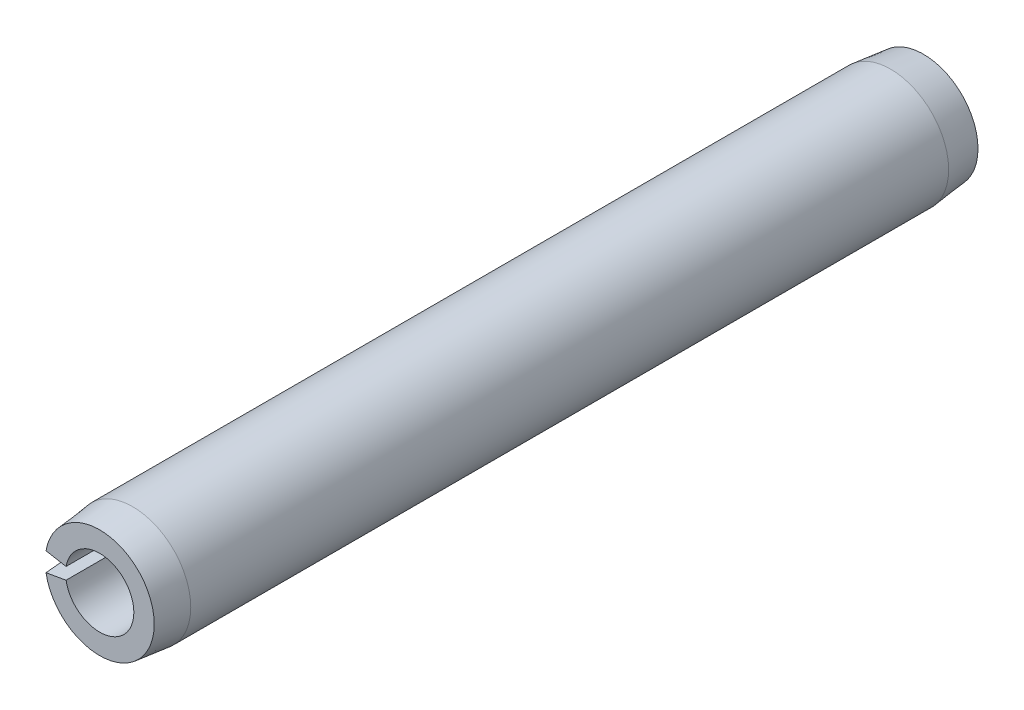
from build123d import *

# Parameters (mm, degrees)
EXTRUDE1_DEPTH      = 17.4625
EXTRUDE1_DEPTH_BACK = 17.4625


with BuildPart() as part:
    # Sketch1 → Extrude1 (new, two sides: drawn at the far end of the back side and taken through both)
    with BuildSketch(Plane.XY.offset(-EXTRUDE1_DEPTH_BACK)):
        with BuildLine():
            Line((-1.425804665, -0.251407832), (-2.426369342, -0.42783438))
            ThreePointArc((-2.426369342, -0.42783438), (2.4638, 0), (-2.426369342, 0.42783438))
            Line((-2.426369342, 0.42783438), (-1.425804665, 0.251407832))
            ThreePointArc((-1.425804665, 0.251407832), (1.4478, 0), (-1.425804665, -0.251407832))
        make_face()
    extrude(amount=EXTRUDE1_DEPTH + EXTRUDE1_DEPTH_BACK)

    # Sketch2 → Cut-Revolve1 (revolve, cut)
    with BuildSketch(Plane(origin=(0, 0, 0), x_dir=(0, 0, -1), z_dir=(1, 0, 0))):
        Polygon((17.4625, 2.3114), (16.0655, 2.4638), (17.4625, 2.4638), align=None)
    cut_revolve1 = revolve(axis=Axis((0, 0, -17.4625), (0, 0, 1)), mode=Mode.SUBTRACT)

    # Mirror1: Cut-Revolve1 across plane
    add(cut_revolve1.mirror(Plane.XY), mode=Mode.SUBTRACT)


solid = part.part
